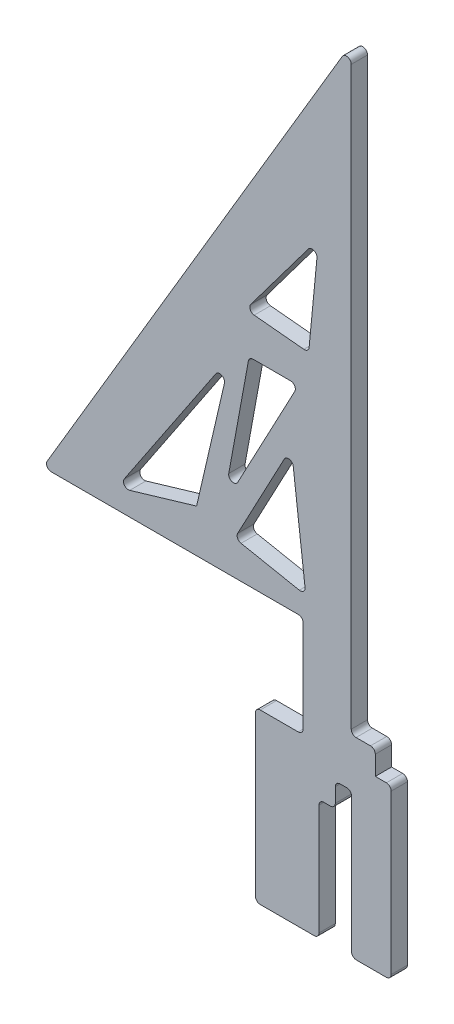
from build123d import *

# Parameters (mm, degrees)
BOSS_EXTRUDE2_DEPTH = 4.2926
BOSS_EXTRUDE3_DEPTH = 4.2926
CUT_EXTRUDE1_DEPTH  = 4.2926
FILLET3_R           = 1.27
SKETCH5_W           = 4.2926
SKETCH5_H           = 31.75
CUT_EXTRUDE2_DEPTH  = 4.2926
SKETCH6_W           = 4.2926
SKETCH6_H           = 38.1
CUT_EXTRUDE3_DEPTH  = 4.2926
SKETCH9_W           = 4.2926
SKETCH9_H           = 44.45
BOSS_EXTRUDE4_DEPTH = 6.35
SKETCH10_W          = 4.2926
SKETCH10_H          = 6.35
BOSS_EXTRUDE5_DEPTH = 6.35
SKETCH12_W          = 4.2926
SKETCH12_H          = 44.45
BOSS_EXTRUDE6_DEPTH = 8.382
FILLET4_R           = 1.27


with BuildPart() as part:
    # Sketch2 → Boss-Extrude2 (new body)
    with BuildSketch(Plane.XY):
        Polygon((6.35, 22.225), (6.35, 101.6), (-6.35, 101.6), (-6.35, 22.225), (-10.541, 22.225), (-10.541, -22.225), (10.541, -22.225), (10.541, 22.225), align=None)
    extrude(amount=BOSS_EXTRUDE2_DEPTH)

    # Sketch2<3> → Boss-Extrude3 (add)
    with BuildSketch(Plane.XY):
        Polygon((-6.35, 101.6), (6.35, 101.6), (6.35, 186.37430696), (-74.996081542, 49.06413634), (-6.35, 49.06413634), align=None)
    extrude(amount=BOSS_EXTRUDE3_DEPTH)

    # Sketch4 → Cut-Extrude1 (cut)
    with BuildSketch(Plane(origin=(0, 0, 0), x_dir=(-1, 0, 0), z_dir=(0, 0, -1))):
        Polygon((2.26175511, 137.499289153), (4.882176806, 110.262347972), (21.501956662, 111.86130989), align=None)
        Polygon((25.53449714, 98.932202401), (34.449187247, 60.416195476), (55.473168553, 54.188396298), align=None)
        Polygon((9.42992166, 86.270055499), (5.634016985, 54.421399088), (24.410527091, 58.107059129), align=None)
        Polygon((7.556063617, 101.433706887), (27.432097362, 64.067482354), (20.599137511, 101.433706887), align=None)
    extrude(amount=-CUT_EXTRUDE1_DEPTH, mode=Mode.SUBTRACT)

    # Fillet3
    fillet3_edges = [part.edges().sort_by_distance(p)[0] for p in [
        (6.35, 186.37430696, 2.1463),
        (-74.996081542, 49.06413634, 2.1463),
        (-6.35, 49.06413634, 2.1463),
        (-20.599137511, 101.433706887, 2.1463),
        (-7.556063617, 101.433706887, 2.1463),
        (-21.501956662, 111.86130989, 2.1463),
        (-4.882176806, 110.262347972, 2.1463),
        (-2.26175511, 137.499289153, 2.1463),
        (-25.53449714, 98.932202401, 2.1463),
        (-55.473168553, 54.188396298, 2.1463),
        (-27.432097362, 64.067482354, 2.1463),
        (-9.42992166, 86.270055499, 2.1463),
        (-5.634016985, 54.421399088, 2.1463),
        (-24.410527091, 58.107059129, 2.1463),
    ]]
    fillet(fillet3_edges, radius=FILLET3_R)

    # Sketch5 → Cut-Extrude2 (cut)
    with BuildSketch(Plane(origin=(0, 0, 0), x_dir=(-1, 0, 0), z_dir=(0, 0, -1))):
        with Locations((0, -6.35)):
            Rectangle(SKETCH5_W, SKETCH5_H)
    extrude(amount=-CUT_EXTRUDE2_DEPTH, mode=Mode.SUBTRACT)

    # Sketch6 → Cut-Extrude3 (cut)
    with BuildSketch(Plane(origin=(0, 0, 0), x_dir=(-1, 0, 0), z_dir=(0, 0, -1))):
        with Locations((-4.2926, -3.175)):
            Rectangle(SKETCH6_W, SKETCH6_H)
    extrude(amount=-CUT_EXTRUDE3_DEPTH, mode=Mode.SUBTRACT)

    # Sketch9 → Boss-Extrude4 (add)
    with BuildSketch(Plane(origin=(10.541, 0, 0), x_dir=(0, 0, -1), z_dir=(1, 0, 0))):
        with Locations((-2.1463, 0)):
            Rectangle(SKETCH9_W, SKETCH9_H)
    extrude(amount=BOSS_EXTRUDE4_DEPTH)

    # Sketch10 → Boss-Extrude5 (add)
    with BuildSketch(Plane(origin=(6.35, 0, 0), x_dir=(0, 0, -1), z_dir=(1, 0, 0))):
        with Locations((-2.1463, 25.4)):
            Rectangle(SKETCH10_W, SKETCH10_H)
    extrude(amount=BOSS_EXTRUDE5_DEPTH)

    # Sketch12 → Boss-Extrude6 (add)
    with BuildSketch(Plane.ZY.offset(10.541)):
        with Locations((2.1463, 0)):
            Rectangle(SKETCH12_W, SKETCH12_H)
    extrude(amount=BOSS_EXTRUDE6_DEPTH)

    # Fillet4
    fillet4_edges = [part.edges().sort_by_distance(p)[0] for p in [
        (6.4389, 15.875, 2.1463),
        (2.1463, 15.875, 2.1463),
        (-2.1463, 9.525, 2.1463),
        (2.1463, 9.525, 2.1463),
        (-6.35, 22.225, 2.1463),
        (-2.1463, -22.225, 2.1463),
        (6.4389, -22.225, 2.1463),
        (16.891, -22.225, 2.1463),
        (16.891, 22.225, 2.1463),
        (6.35, 28.575, 2.1463),
        (12.7, 28.575, 2.1463),
        (-18.923, -22.225, 2.1463),
        (-18.923, 22.225, 2.1463),
    ]]
    fillet(fillet4_edges, radius=FILLET4_R)


solid = part.part
